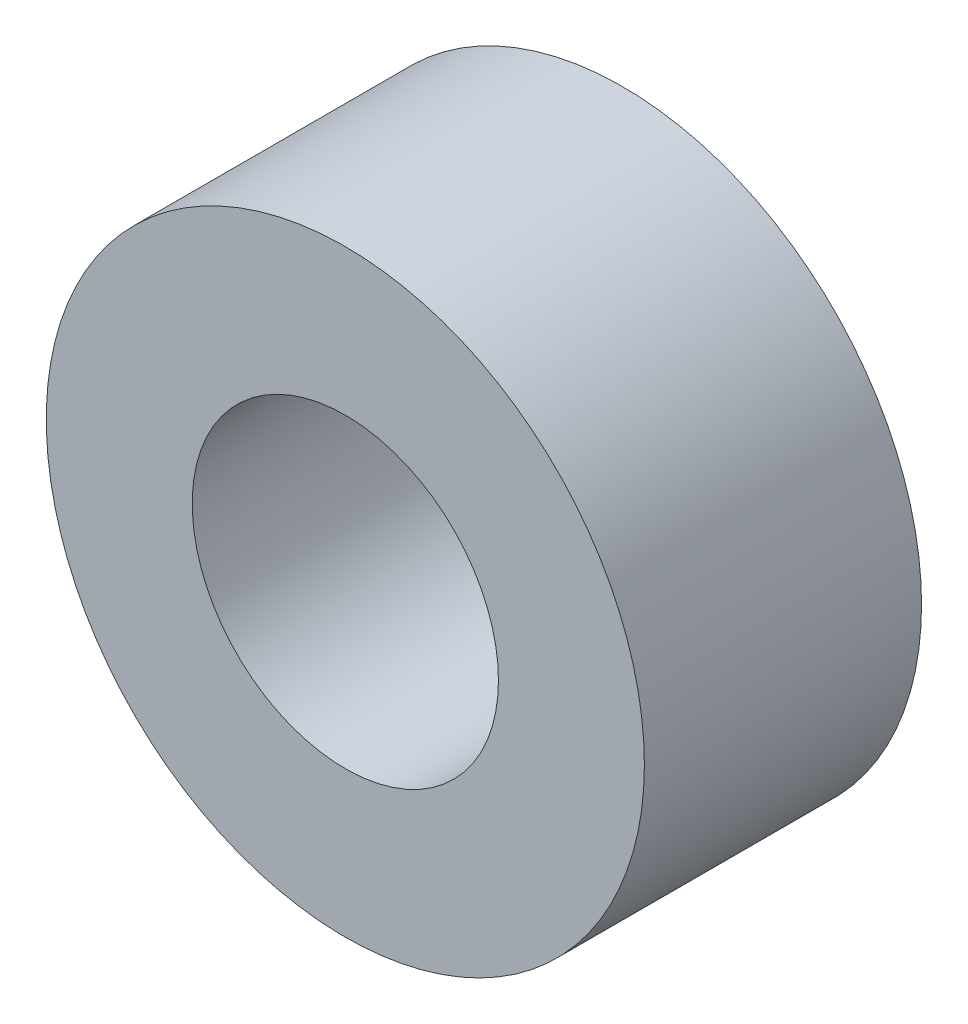
from build123d import *


with BuildPart() as part:
    # Sketch1 → Revolve1 (revolve)
    with BuildSketch(Plane(origin=(0, 0, 0), x_dir=(0, 0, -1), z_dir=(1, 0, 0)), mode=Mode.PRIVATE) as revolve1_sk:
        Polygon((0, 3.2512), (0, 6.35), (5.884949876, 6.35), (5.884949876, 4.6736), (6.392949876, 4.6736), (6.392949876, 3.2512), align=None)
    revolve(revolve1_sk.sketch.rotate(Axis((0, 0, 0), (0, 0, -1)), 90), axis=Axis((0, 0, 0), (0, 0, -1)))


solid = part.part
